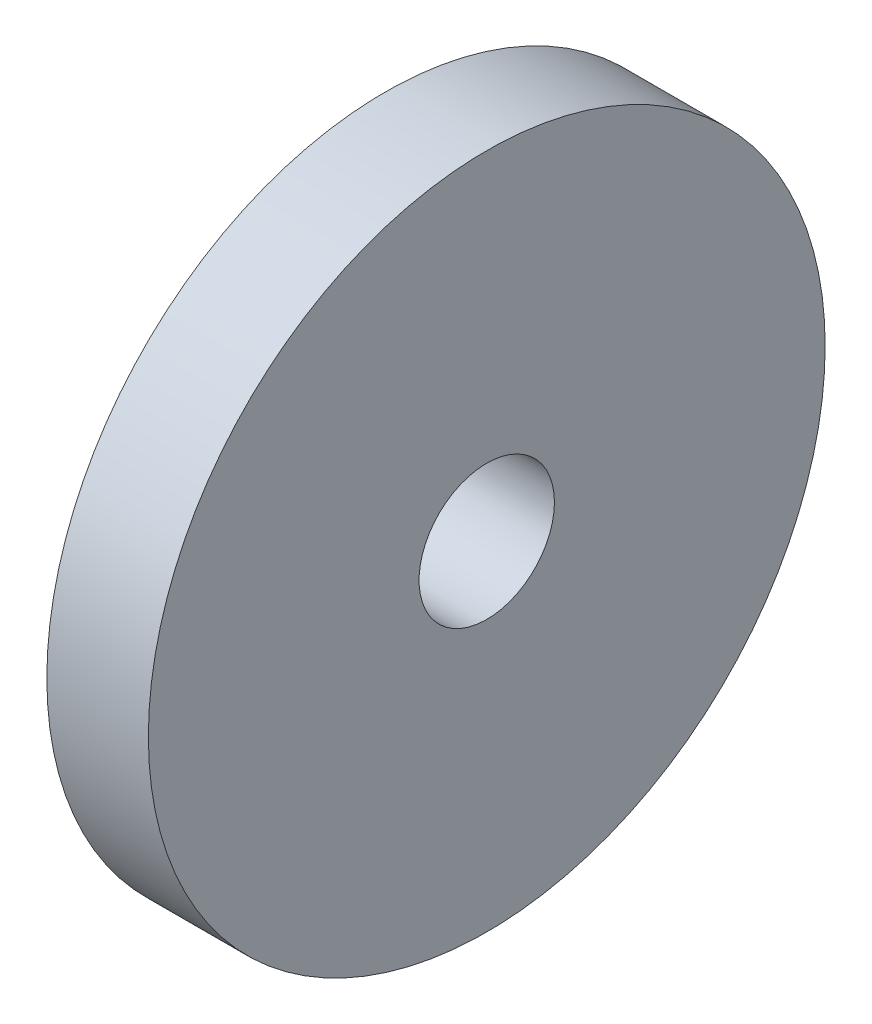
from build123d import *

# Parameters (mm, degrees)
SKETCH_1_R          = 10
EXTRUDE_1_DEPTH     = 3
SKETCH_2_R          = 2
CUT_EXTRUDE_1_DEPTH = 3


with BuildPart() as part:
    # 草图1 → 凸台-拉伸1 (new body)
    with BuildSketch(Plane(origin=(0, 0, 0), x_dir=(0, 0, -1), z_dir=(1, 0, 0))):
        Circle(SKETCH_1_R)
    extrude(amount=EXTRUDE_1_DEPTH)

    # 草图2 → 切除-拉伸1 (cut)
    with BuildSketch(Plane(origin=(3, 0, 0), x_dir=(0, 0, -1), z_dir=(1, 0, 0))):
        Circle(SKETCH_2_R)
    extrude(amount=-CUT_EXTRUDE_1_DEPTH, mode=Mode.SUBTRACT)


solid = part.part
